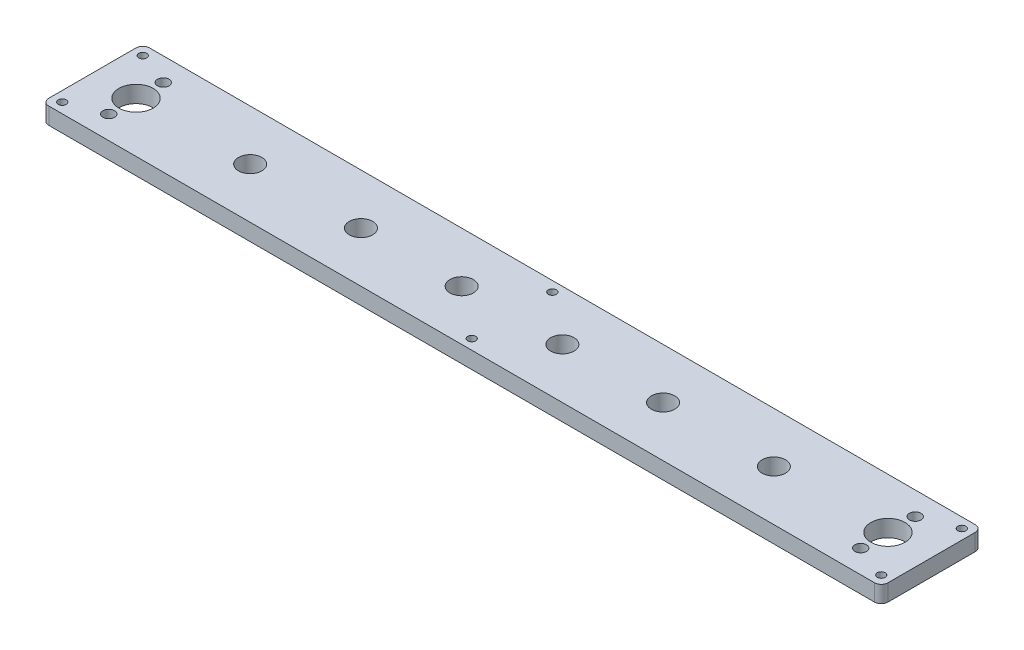
from build123d import *

# Parameters (mm, degrees)
SKETCH1_W           = 317.5
SKETCH1_H           = 38.1
BOSS_EXTRUDE1_DEPTH = 3.175
SKETCH2_R           = 4.4196
SKETCH2_R_2         = 6.477
SKETCH2_R_3         = 2.19075
CUT_EXTRUDE1_DEPTH  = 161.014960238
SKETCH3_R           = 1.5113
CUT_EXTRUDE2_DEPTH  = 161.014960238
FILLET1_R           = 2.54


with BuildPart() as part:
    # Sketch1 → Boss-Extrude1 (new, symmetric)
    with BuildSketch(Plane(origin=(0, 0, 0), x_dir=(1, 0, 0), z_dir=(0, 1, 0))):
        Rectangle(SKETCH1_W, SKETCH1_H)
    extrude(amount=BOSS_EXTRUDE1_DEPTH, both=True)

    # Sketch2 → Cut-Extrude1 (cut, through all)
    with BuildSketch(Plane(origin=(0, 3.175, 0), x_dir=(1, 0, 0), z_dir=(0, 1, 0))):
        with Locations(Location((-99.06, 0, 0), (0, 0, 270))):
            Circle(SKETCH2_R)
        with Locations(Location((-57.15, 0, 0), (0, 0, 270))):
            Circle(SKETCH2_R)
        with Locations(Location((-19.05, 0, 0), (0, 0, 270))):
            Circle(SKETCH2_R)
        with Locations(Location((19.05, 0, 0), (0, 0, 270))):
            Circle(SKETCH2_R)
        with Locations(Location((57.15, 0, 0), (0, 0, 270))):
            Circle(SKETCH2_R)
        with Locations(Location((-142.24, 0, 0), (0, 0, 270))):
            Circle(SKETCH2_R_2)
        with Locations(Location((-142.24, -10.31875, 0), (0, 0, 270))):
            Circle(SKETCH2_R_3)
        with Locations(Location((-142.24, 10.31875, 0), (0, 0, 270))):
            Circle(SKETCH2_R_3)
        with Locations(Location((142.24, 0, 0), (0, 0, 270))):
            Circle(SKETCH2_R_2)
        with Locations(Location((142.24, -10.31875, 0), (0, 0, 270))):
            Circle(SKETCH2_R_3)
        with Locations(Location((142.24, 10.31875, 0), (0, 0, 270))):
            Circle(SKETCH2_R_3)
        with Locations(Location((99.06, 0, 0), (0, 0, 270))):
            Circle(SKETCH2_R)
    extrude(amount=-CUT_EXTRUDE1_DEPTH, mode=Mode.SUBTRACT)

    # Sketch3 → Cut-Extrude2 (cut, through all)
    with BuildSketch(Plane(origin=(0, 3.175, 0), x_dir=(1, 0, 0), z_dir=(0, 1, 0))):
        with Locations(Location((-154.94, 15.24, 0), (0, 0, 270))):
            Circle(SKETCH3_R)
        with Locations(Location((-154.94, -15.24, 0), (0, 0, 270))):
            Circle(SKETCH3_R)
        with Locations(Location((154.94, -15.24, 0), (0, 0, 270))):
            Circle(SKETCH3_R)
        with Locations(Location((154.94, 15.24, 0), (0, 0, 270))):
            Circle(SKETCH3_R)
        with Locations(Location((0, 15.24, 0), (0, 0, 270))):
            Circle(SKETCH3_R)
        with Locations(Location((0, -15.24, 0), (0, 0, 270))):
            Circle(SKETCH3_R)
    extrude(amount=-CUT_EXTRUDE2_DEPTH, mode=Mode.SUBTRACT)

    # Fillet1
    fillet1_edges = [part.edges().sort_by_distance(p)[0] for p in [
        (158.75, 0, 19.05),
        (-158.75, 0, 19.05),
        (-158.75, 0, -19.05),
        (158.75, 0, -19.05),
    ]]
    fillet(fillet1_edges, radius=FILLET1_R)


solid = part.part
